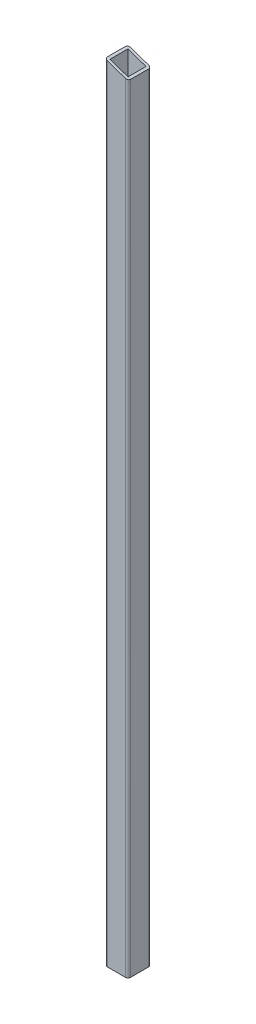
from build123d import *

# Parameters (mm, degrees)
BOSS_EXTRUDE1_DEPTH     = 870
SKETCH3_W               = 20
SKETCH3_H               = 20
CUT_EXTRUDE1_DEPTH      = 1040.5
CUT_EXTRUDE6_DEPTH      = 871.675140337
CUT_EXTRUDE6_DEPTH_BACK = 871.675140337


with BuildPart() as part:
    # Sketch1 → Boss-Extrude1 (new body)
    with BuildSketch(Plane(origin=(0, 0, 0), x_dir=(1, 0, 0), z_dir=(0, 1, 0))):
        with BuildLine():
            Line((2.8, 0), (22.8, 0))
            ThreePointArc((22.8, 0), (24.779898987, -0.820101013), (25.6, -2.8))
            Line((25.6, -2.8), (25.6, -22.8))
            ThreePointArc((25.6, -22.8), (24.779898987, -24.779898987), (22.8, -25.6))
            Line((22.8, -25.6), (2.8, -25.6))
            ThreePointArc((2.8, -25.6), (0.820101013, -24.779898987), (0, -22.8))
            Line((0, -22.8), (0, -2.8))
            ThreePointArc((0, -2.8), (0.820101013, -0.820101013), (2.8, 0))
        make_face()
    extrude(amount=BOSS_EXTRUDE1_DEPTH)

    # Sketch3 → Cut-Extrude1 (cut)
    with BuildSketch(Plane(origin=(0, 0, 0), x_dir=(-1, 0, 0), z_dir=(0, -1, 0))):
        with Locations((-12.8, -12.8)):
            Rectangle(SKETCH3_W, SKETCH3_H)
    extrude(amount=-CUT_EXTRUDE1_DEPTH, mode=Mode.SUBTRACT)

    # Sketch4 → Cut-Extrude6 (cut, two sides: drawn at the far end of the back side and taken through both)
    with BuildSketch(Plane(origin=(0, 0, 22.8), x_dir=(-1, 0, 0), z_dir=(0, 0, -1)).offset(-CUT_EXTRUDE6_DEPTH_BACK)):
        Polygon((1655.369600379, 1439.989463611), (0, 870), (-25.6, 861.1852131), (-1680.969600379, 291.195749489), (-2820.948527601, 3601.934950248), (515.390673158, 4750.728664369), align=None)
    extrude(amount=CUT_EXTRUDE6_DEPTH + CUT_EXTRUDE6_DEPTH_BACK, mode=Mode.SUBTRACT)


solid = part.part
